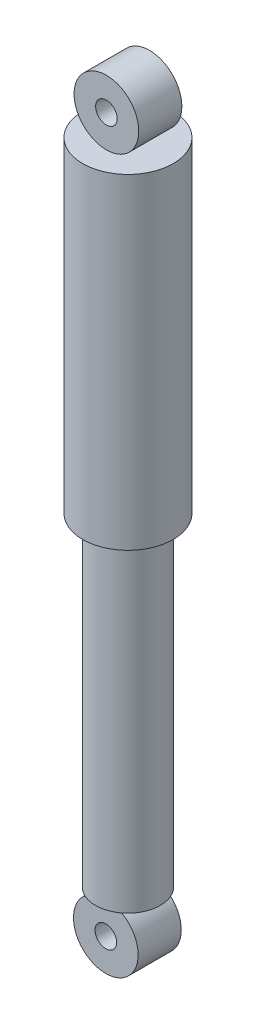
from build123d import *

# Parameters (mm, degrees)
SZKIC1_R                    = 15
DODANIE_WYCI_GNI_CIE1_DEPTH = 20
SZKIC2_R                    = 5
WYTNIJ_WYCI_GNI_CIE1_DEPTH  = 20
SZKIC3_R                    = 15
DODANIE_WYCI_GNI_CIE2_DEPTH = 150
SZKIC4_R                    = 21
SZKIC4_R_2                  = 15.5
DODANIE_WYCI_GNI_CIE3_DEPTH = 150
SZKIC6_R                    = 21
DODANIE_WYCI_GNI_CIE4_DEPTH = 1
SZKIC7_R                    = 15
SZKIC7_R_2                  = 5
DODANIE_WYCI_GNI_CIE5_DEPTH = 20


with BuildPart() as part:
    # Szkic1 → Dodanie-wyciągnięcie1 (new body)
    with BuildSketch(Plane.XY):
        Circle(SZKIC1_R)
    extrude(amount=DODANIE_WYCI_GNI_CIE1_DEPTH)

    # Szkic2 → Wytnij-wyciągnięcie1 (cut)
    with BuildSketch(Plane.XY.offset(20)):
        Circle(SZKIC2_R)
    extrude(amount=-WYTNIJ_WYCI_GNI_CIE1_DEPTH, mode=Mode.SUBTRACT)


with BuildPart() as body_2:
    # Szkic3 → Dodanie-wyciągnięcie2 (new body)
    with BuildSketch(Plane(origin=(0, 15, 0), x_dir=(1, 0, 0), z_dir=(0, 1, 0))):
        with Locations(Location((0.27892553, -10, 0), (0, 0, 270))):
            Circle(SZKIC3_R)
    extrude(amount=DODANIE_WYCI_GNI_CIE2_DEPTH)


with BuildPart() as body_3:
    # Szkic4 → Dodanie-wyciągnięcie3 (new body)
    with BuildSketch(Plane(origin=(0, 165, 0), x_dir=(1, 0, 0), z_dir=(0, 1, 0))):
        with Locations(Location((0.27892553, -10, 0), (0, 0, 270))):
            Circle(SZKIC4_R)
        with Locations(Location((0.27892553, -10, 0), (0, 0, 270))):
            Circle(SZKIC4_R_2, mode=Mode.SUBTRACT)
    extrude(amount=DODANIE_WYCI_GNI_CIE3_DEPTH)

    # Szkic6 → Dodanie-wyciągnięcie4 (add)
    with BuildSketch(Plane(origin=(0, 315, 0), x_dir=(1, 0, 0), z_dir=(0, 1, 0))):
        with Locations(Location((0.27892553, -10, 0), (0, 0, 270))):
            Circle(SZKIC6_R)
    extrude(amount=DODANIE_WYCI_GNI_CIE4_DEPTH)


with BuildPart() as body_4:
    # Szkic7 → Dodanie-wyciągnięcie5 (new body)
    with BuildSketch(Plane.XY):
        with Locations((0.27892553, 331)):
            Circle(SZKIC7_R)
        with Locations((0.27892553, 331)):
            Circle(SZKIC7_R_2, mode=Mode.SUBTRACT)
    extrude(amount=DODANIE_WYCI_GNI_CIE5_DEPTH)


solid = Compound([part.part, body_2.part, body_3.part, body_4.part])
